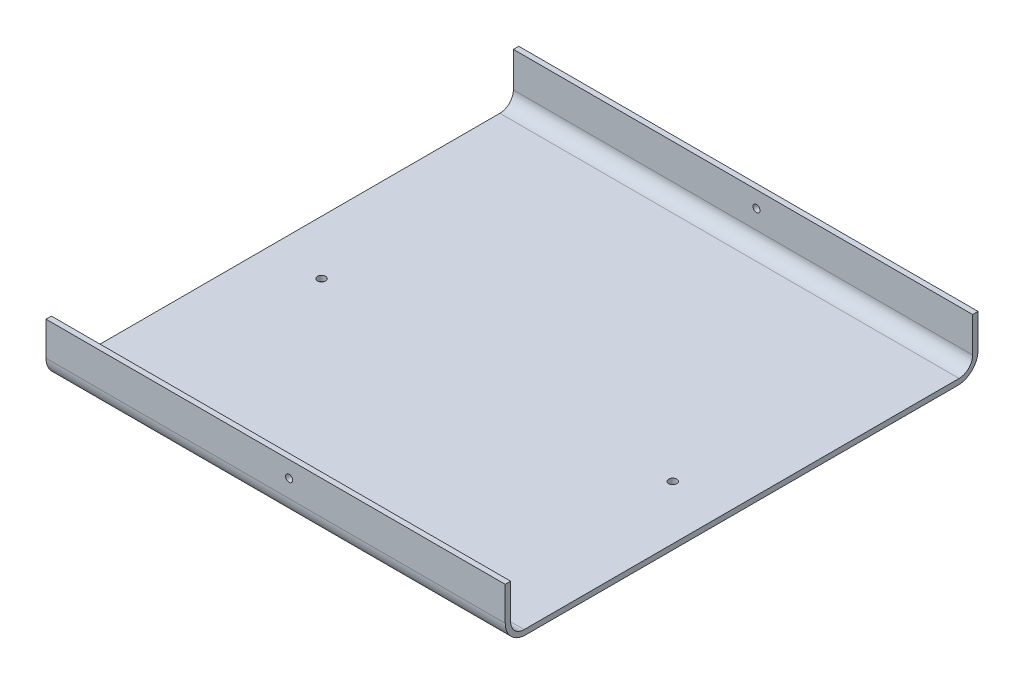
from build123d import *

# Parameters (mm, degrees)
BOSS_EXTRUDE1_DEPTH = 170
SKETCH3_R           = 1.5
CUT_EXTRUDE2_DEPTH  = 170
SKETCH4_R           = 1.3
CUT_EXTRUDE3_DEPTH  = 200


with BuildPart() as part:
    # Sketch2 → Boss-Extrude1 (new body)
    with BuildSketch(Plane(origin=(0, 0, 0), x_dir=(0, 0, -1), z_dir=(1, 0, 0))):
        with BuildLine():
            Line((-80, 0), (80, 0))
            ThreePointArc((80, 0), (85.303300859, 2.196699141), (87.5, 7.5))
            Line((87.5, 7.5), (87.5, 20))
            Line((87.5, 20), (85.5, 20))
            Line((85.5, 20), (85.5, 7))
            ThreePointArc((85.5, 7), (84.035533906, 3.464466094), (80.5, 2))
            Line((80.5, 2), (-80.5, 2))
            ThreePointArc((-80.5, 2), (-84.035533906, 3.464466094), (-85.5, 7))
            Line((-85.5, 7), (-85.5, 20))
            Line((-85.5, 20), (-87.5, 20))
            Line((-87.5, 20), (-87.5, 7.5))
            ThreePointArc((-87.5, 7.5), (-85.303300859, 2.196699141), (-80, 0))
        make_face()
    extrude(amount=BOSS_EXTRUDE1_DEPTH)

    # Sketch3 → Cut-Extrude2 (cut)
    with BuildSketch(Plane(origin=(0, 2, 0), x_dir=(1, 0, 0), z_dir=(0, 1, 0))):
        with Locations(Location((20, -5.5, 0), (0, 0, 270))):
            Circle(SKETCH3_R)
        with Locations(Location((150, -5.5, 0), (0, 0, 270))):
            Circle(SKETCH3_R)
    extrude(amount=-CUT_EXTRUDE2_DEPTH, mode=Mode.SUBTRACT)

    # Sketch4 → Cut-Extrude3 (cut)
    with BuildSketch(Plane.XY.offset(87.5)):
        with Locations((90, 14)):
            Circle(SKETCH4_R)
    extrude(amount=-CUT_EXTRUDE3_DEPTH, mode=Mode.SUBTRACT)


solid = part.part
